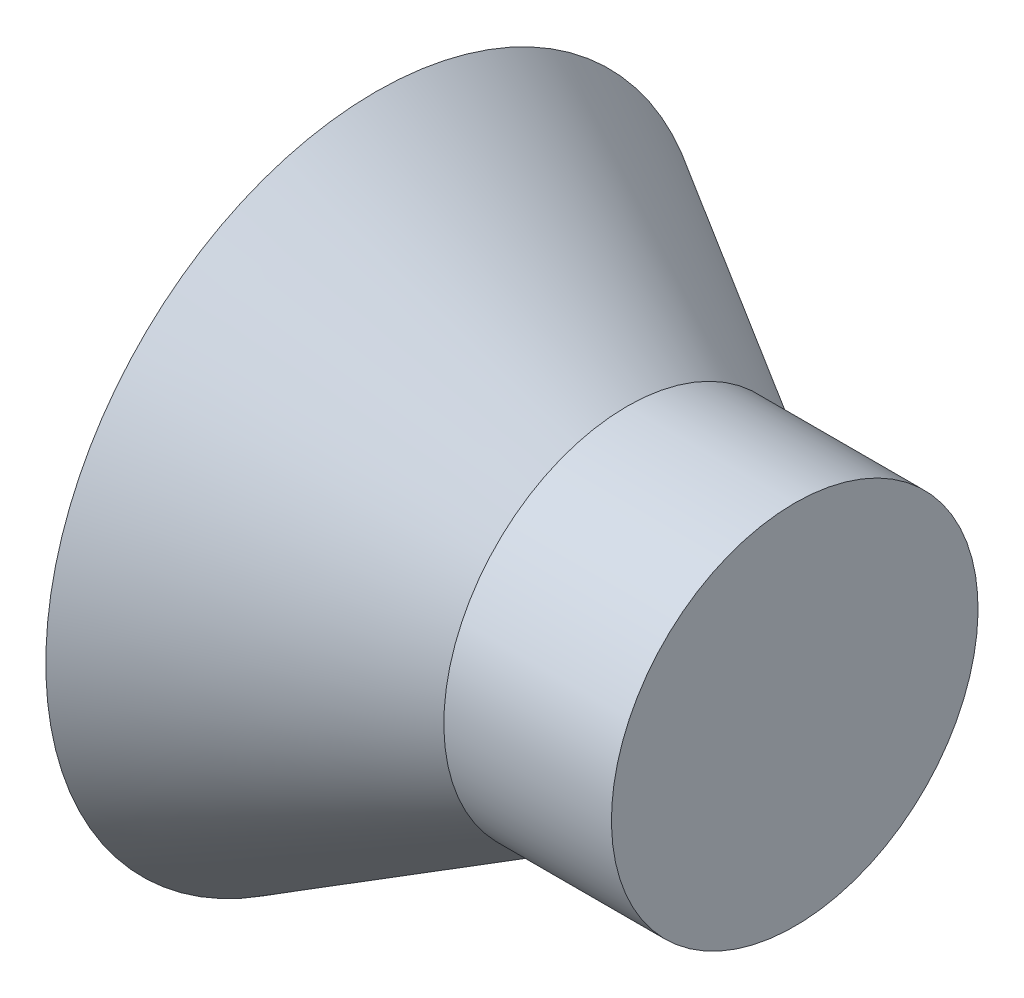
from build123d import *

# Parameters (mm, degrees)
SKETCH_2_W          = 0.8
SKETCH_2_H          = 1.6
SKETCH_2_W_2        = 1.6
SKETCH_2_H_2        = 0.8
CUT_EXTRUDE_1_DEPTH = 0.5


with BuildPart() as part:
    # 草图1 → 旋转1 (revolve)
    with BuildSketch(Plane.XY):
        Polygon((0, 0), (0, 3.15), (2.4, 1.75), (4, 1.75), (4, 0), align=None)
    revolve(axis=Axis((4, 0, 0), (-1, 0, 0)))

    # 草图2 → 切除-拉伸1 (cut)
    with BuildSketch(Plane.ZY):
        with Locations((0, -1.2)):
            Rectangle(SKETCH_2_W, SKETCH_2_H)
        with Locations((1.2, 0)):
            Rectangle(SKETCH_2_W_2, SKETCH_2_H_2)
        with Locations((0, 1.2)):
            Rectangle(SKETCH_2_W, SKETCH_2_H)
        Rectangle(SKETCH_2_W, SKETCH_2_H_2)
        with Locations((-1.2, 0)):
            Rectangle(SKETCH_2_W_2, SKETCH_2_H_2)
    extrude(amount=-CUT_EXTRUDE_1_DEPTH, mode=Mode.SUBTRACT)


solid = part.part
